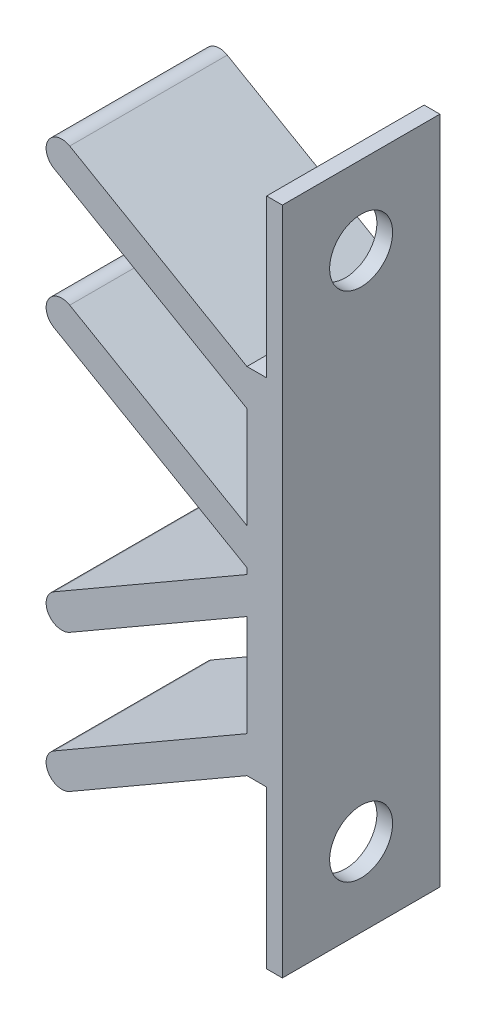
from build123d import *

# Parameters (mm, degrees)
BOSS_EXTRUDE1_DEPTH = 8
SKETCH2_R           = 1.6
CUT_EXTRUDE1_DEPTH  = 9.5


with BuildPart() as part:
    # Sketch1 → Boss-Extrude1 (new body)
    with BuildSketch(Plane(origin=(0, 0, 0), x_dir=(0, 1, 0), z_dir=(0, 0, 1))):
        with BuildLine():
            Line((-16.649176641, -6.17541168), (-16.649176641, -5.37541168))
            Line((-16.649176641, -5.37541168), (-8.649176641, -5.37541168))
            Line((-8.649176641, -5.37541168), (-8.649176641, -4.37541168))
            Line((-8.649176641, -4.37541168), (-13.845329064, 4.62458832))
            ThreePointArc((-13.845329064, 4.62458832), (-13.552508741, 5.717408644), (-12.459688418, 5.42458832))
            Line((-12.459688418, 5.42458832), (-6.80165578, -4.37541168))
            Line((-6.80165578, -4.37541168), (-1.649176641, -4.37541168))
            Line((-1.649176641, -4.37541168), (-6.845329064, 4.62458832))
            ThreePointArc((-6.845329064, 4.62458832), (-6.552508741, 5.717408644), (-5.459688418, 5.42458832))
            Line((-5.459688418, 5.42458832), (0.19834422, -4.37541168))
            Line((0.19834422, -4.37541168), (0.503302498, -4.37541168))
            Line((0.503302498, -4.37541168), (6.161335136, 5.42458832))
            ThreePointArc((6.161335136, 5.42458832), (7.254155459, 5.717408644), (7.546975782, 4.62458832))
            Line((7.546975782, 4.62458832), (2.350823359, -4.37541168))
            Line((2.350823359, -4.37541168), (7.503302498, -4.37541168))
            Line((7.503302498, -4.37541168), (13.161335136, 5.42458832))
            ThreePointArc((13.161335136, 5.42458832), (14.254155459, 5.717408644), (14.546975782, 4.62458832))
            Line((14.546975782, 4.62458832), (9.350823359, -4.37541168))
            Line((9.350823359, -4.37541168), (9.350823359, -5.37541168))
            Line((9.350823359, -5.37541168), (17.350823359, -5.37541168))
            Line((17.350823359, -5.37541168), (17.350823359, -6.17541168))
            Line((17.350823359, -6.17541168), (-16.649176641, -6.17541168))
        make_face()
    extrude(amount=BOSS_EXTRUDE1_DEPTH)

    # Sketch2 → Cut-Extrude1 (cut)
    with BuildSketch(Plane(origin=(5.37541168, 0, 0), x_dir=(0, -1, 0), z_dir=(-1, 0, 0))):
        with Locations(Location((-13.350823359, 4, 0), (0, 0, 90))):
            Circle(SKETCH2_R)
        with Locations(Location((12.649176641, 4, 0), (0, 0, 90))):
            Circle(SKETCH2_R)
    extrude(amount=-CUT_EXTRUDE1_DEPTH, mode=Mode.SUBTRACT)


solid = part.part
